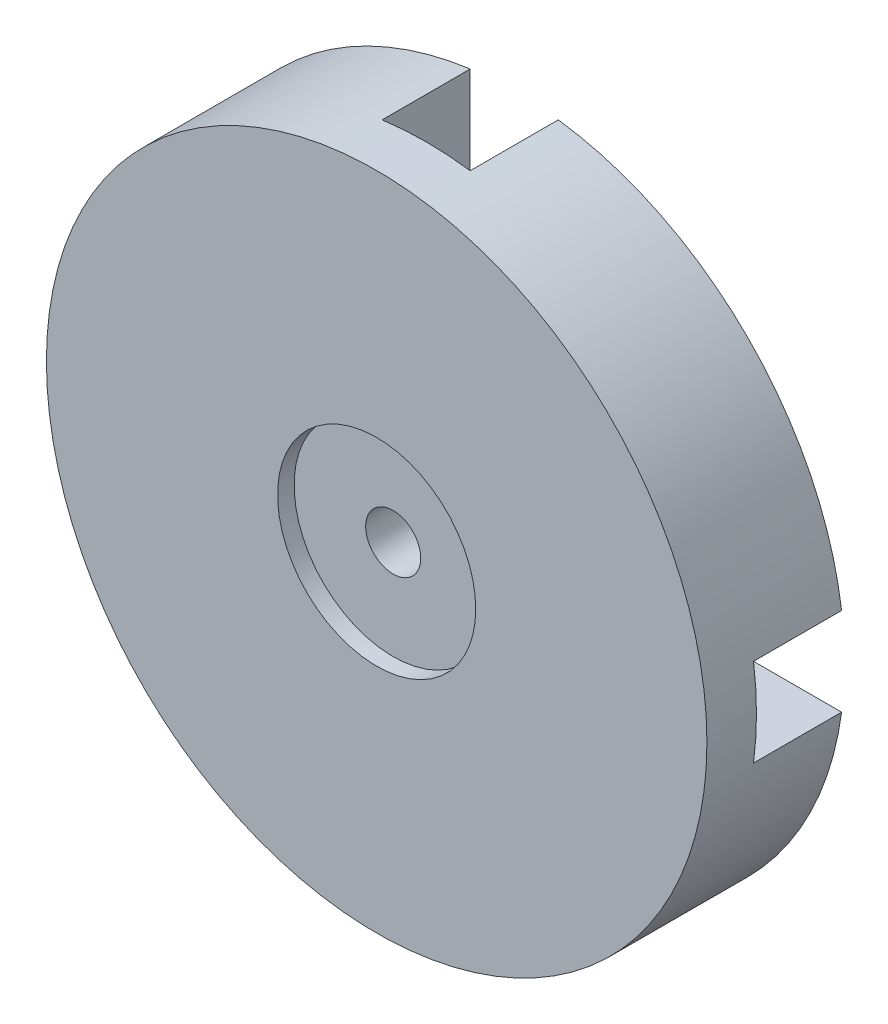
from build123d import *

# Parameters (mm, degrees)
ESQUISSE1_R                  = 60
BOSS_EXTRU_1_DEPTH           = 25
ESQUISSE2_R                  = 18
ENL_V_MAT_EXTRU_1_DEPTH      = 3
ENL_V_MAT_EXTRU_2_DEPTH      = 88.658428003
ENL_V_MAT_EXTRU_2_DEPTH_BACK = 88.658428003
ESQUISSE3_R                  = 5
ESQUISSE4_W                  = 45
ESQUISSE4_H                  = 16
ESQUISSE4_W_2                = 16
ESQUISSE4_H_2                = 45
ENL_V_MAT_EXTRU_3_DEPTH      = 16


with BuildPart() as part:
    # Esquisse1 → Boss.-Extru.1 (new body)
    with BuildSketch(Plane.XY):
        Circle(ESQUISSE1_R)
    extrude(amount=BOSS_EXTRU_1_DEPTH)

    # Esquisse2 → Enlèv. mat.-Extru.1 (cut)
    with BuildSketch(Plane.XY.offset(25)):
        Circle(ESQUISSE2_R)
    extrude(amount=-ENL_V_MAT_EXTRU_1_DEPTH, mode=Mode.SUBTRACT)

    # Esquisse3 → Enlèv. mat.-Extru.2 (cut, two sides: drawn at the far end of the back side and taken through both)
    with BuildSketch(Plane.XY.offset(22).offset(-ENL_V_MAT_EXTRU_2_DEPTH_BACK)):
        Circle(ESQUISSE3_R)
    extrude(amount=ENL_V_MAT_EXTRU_2_DEPTH + ENL_V_MAT_EXTRU_2_DEPTH_BACK, mode=Mode.SUBTRACT)

    # Esquisse4 → Enlèv. mat.-Extru.3 (cut)
    with BuildSketch(Plane(origin=(0, 0, 0), x_dir=(-1, 0, 0), z_dir=(0, 0, -1))):
        with Locations((37.5, 0)):
            Rectangle(ESQUISSE4_W, ESQUISSE4_H)
        with Locations((0, -37.5)):
            Rectangle(ESQUISSE4_W_2, ESQUISSE4_H_2)
        with Locations((-37.5, 0)):
            Rectangle(ESQUISSE4_W, ESQUISSE4_H)
        with Locations((0, 37.5)):
            Rectangle(ESQUISSE4_W_2, ESQUISSE4_H_2)
    extrude(amount=-ENL_V_MAT_EXTRU_3_DEPTH, mode=Mode.SUBTRACT)


solid = part.part
